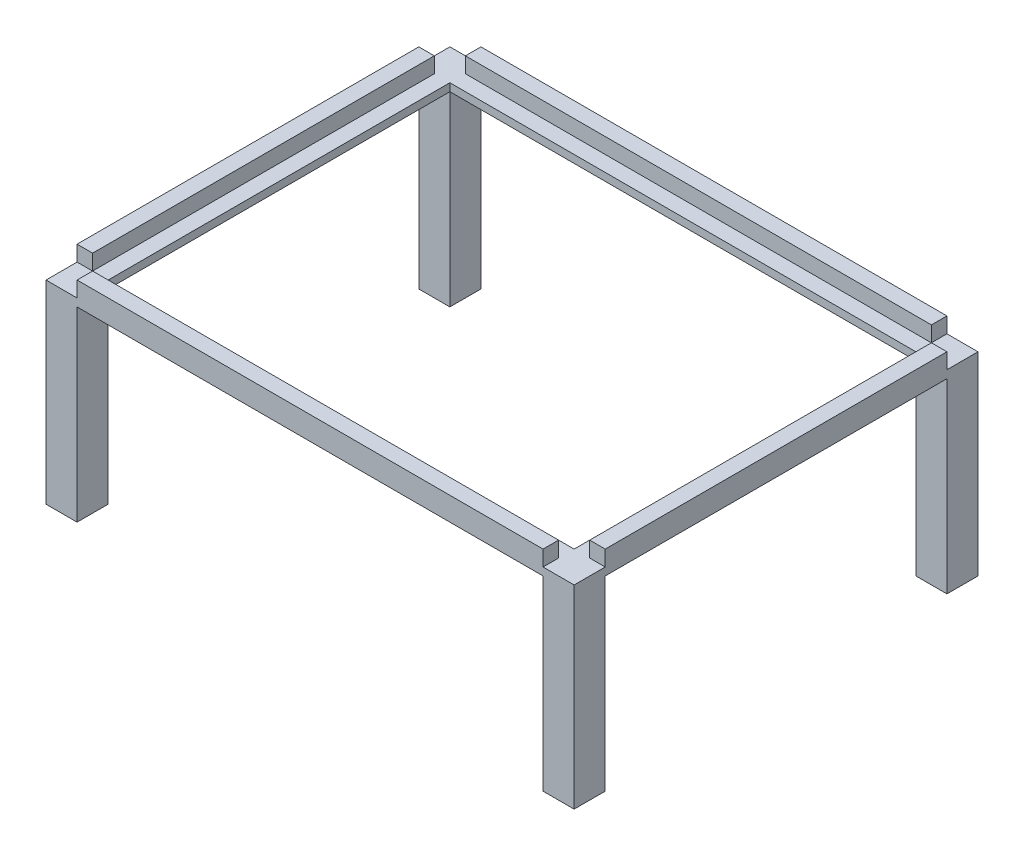
from build123d import *

# Parameters (mm, degrees)
SKETCH1_W           = 431.8
SKETCH1_H           = 330.2
SKETCH1_W_2         = 381
SKETCH1_H_2         = 279.4
BOSS_EXTRUDE1_DEPTH = 6.35
SKETCH2_W           = 25.4
SKETCH2_H           = 25.4
BOSS_EXTRUDE2_DEPTH = 152.4
SKETCH3_W           = 12.7
SKETCH3_H           = 279.4
SKETCH3_W_2         = 381
SKETCH3_H_2         = 12.7
BOSS_EXTRUDE3_DEPTH = 12.7


with BuildPart() as part:
    # Sketch1 → Boss-Extrude1 (new body)
    with BuildSketch(Plane(origin=(0, 0, 0), x_dir=(1, 0, 0), z_dir=(0, 1, 0))):
        Rectangle(SKETCH1_W, SKETCH1_H)
        Rectangle(SKETCH1_W_2, SKETCH1_H_2, mode=Mode.SUBTRACT)
    extrude(amount=BOSS_EXTRUDE1_DEPTH)

    # Sketch2 → Boss-Extrude2 (add)
    with BuildSketch(Plane(origin=(0, 0, 0), x_dir=(1, 0, 0), z_dir=(0, 1, 0))):
        with Locations((-203.2, -152.4)):
            Rectangle(SKETCH2_W, SKETCH2_H)
        with Locations((-203.2, 152.4)):
            Rectangle(SKETCH2_W, SKETCH2_H)
        with Locations((203.2, 152.4)):
            Rectangle(SKETCH2_W, SKETCH2_H)
        with Locations((203.2, -152.4)):
            Rectangle(SKETCH2_W, SKETCH2_H)
    extrude(amount=-BOSS_EXTRUDE2_DEPTH)

    # Sketch3 → Boss-Extrude3 (add)
    with BuildSketch(Plane(origin=(0, 6.35, 0), x_dir=(1, 0, 0), z_dir=(0, 1, 0))):
        with Locations((-209.55, 0)):
            Rectangle(SKETCH3_W, SKETCH3_H)
        with Locations((0, 158.75)):
            Rectangle(SKETCH3_W_2, SKETCH3_H_2)
        with Locations((209.55, 0)):
            Rectangle(SKETCH3_W, SKETCH3_H)
        with Locations((0, -158.75)):
            Rectangle(SKETCH3_W_2, SKETCH3_H_2)
    extrude(amount=BOSS_EXTRUDE3_DEPTH)


solid = part.part
